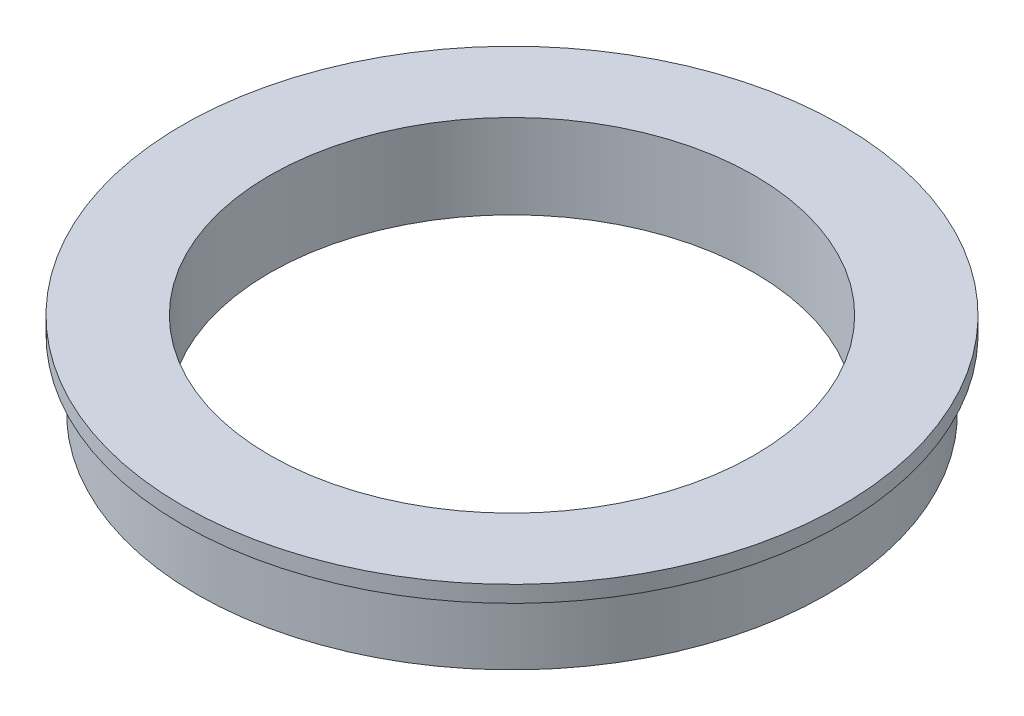
from build123d import *

# Parameters (mm, degrees)
SKETCH_1_R      = 32.5
SKETCH_1_R_2    = 25
EXTRUDE_1_DEPTH = 7
SKETCH_2_R      = 34
SKETCH_2_R_2    = 25
EXTRUDE_2_DEPTH = 1.7


with BuildPart() as part:
    # 草图1 → 凸台-拉伸1 (new body)
    with BuildSketch(Plane(origin=(0, 0, 0), x_dir=(1, 0, 0), z_dir=(0, 1, 0))):
        with Locations(Location((0, 0, 0), (0, 0, 270))):
            Circle(SKETCH_1_R)
        with Locations(Location((0, 0, 0), (0, 0, 270))):
            Circle(SKETCH_1_R_2, mode=Mode.SUBTRACT)
    extrude(amount=EXTRUDE_1_DEPTH)

    # 草图2 → 凸台-拉伸2 (add)
    with BuildSketch(Plane(origin=(0, 7, 0), x_dir=(1, 0, 0), z_dir=(0, 1, 0))):
        with Locations(Location((0, 0, 0), (0, 0, 270))):
            Circle(SKETCH_2_R)
        with Locations(Location((0, 0, 0), (0, 0, 270))):
            Circle(SKETCH_2_R_2, mode=Mode.SUBTRACT)
    extrude(amount=EXTRUDE_2_DEPTH)


solid = part.part
